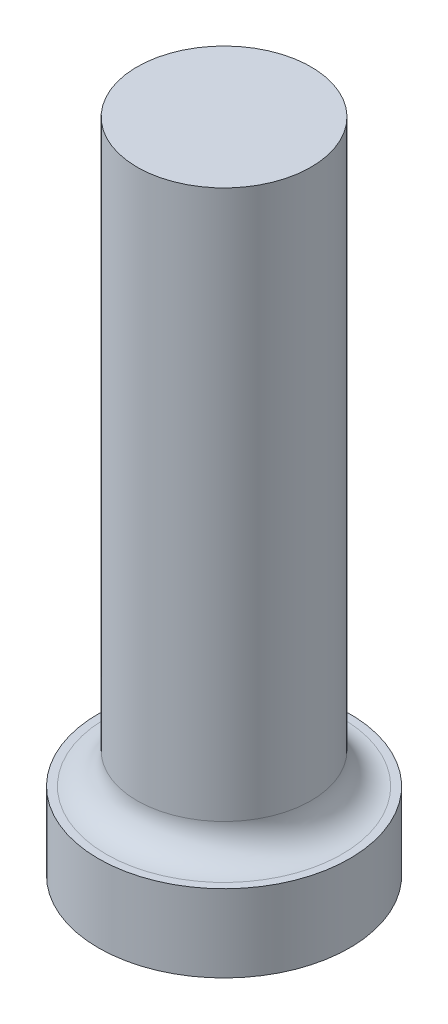
from build123d import *

# Parameters (mm, degrees)
SKETCH2_R           = 2.25
BOSS_EXTRUDE1_DEPTH = 15
SKETCH2_3_R         = 3.25
BOSS_EXTRUDE2_DEPTH = 2
FILLET1_R           = 0.8


with BuildPart() as part:
    # Sketch2 → Boss-Extrude1 (new body)
    with BuildSketch(Plane(origin=(0, 0, 0), x_dir=(1, 0, 0), z_dir=(0, 1, 0))):
        Circle(SKETCH2_R)
    extrude(amount=BOSS_EXTRUDE1_DEPTH)

    # Sketch2<3> → Boss-Extrude2 (add)
    with BuildSketch(Plane(origin=(0, 0, 0), x_dir=(1, 0, 0), z_dir=(0, 1, 0))):
        Circle(SKETCH2_3_R)
    extrude(amount=-BOSS_EXTRUDE2_DEPTH)

    # Fillet1
    fillet1_edges = [part.edges().sort_by_distance(p)[0] for p in [
        (-2.25, 0, 0),
    ]]
    fillet(fillet1_edges, radius=FILLET1_R)


solid = part.part
